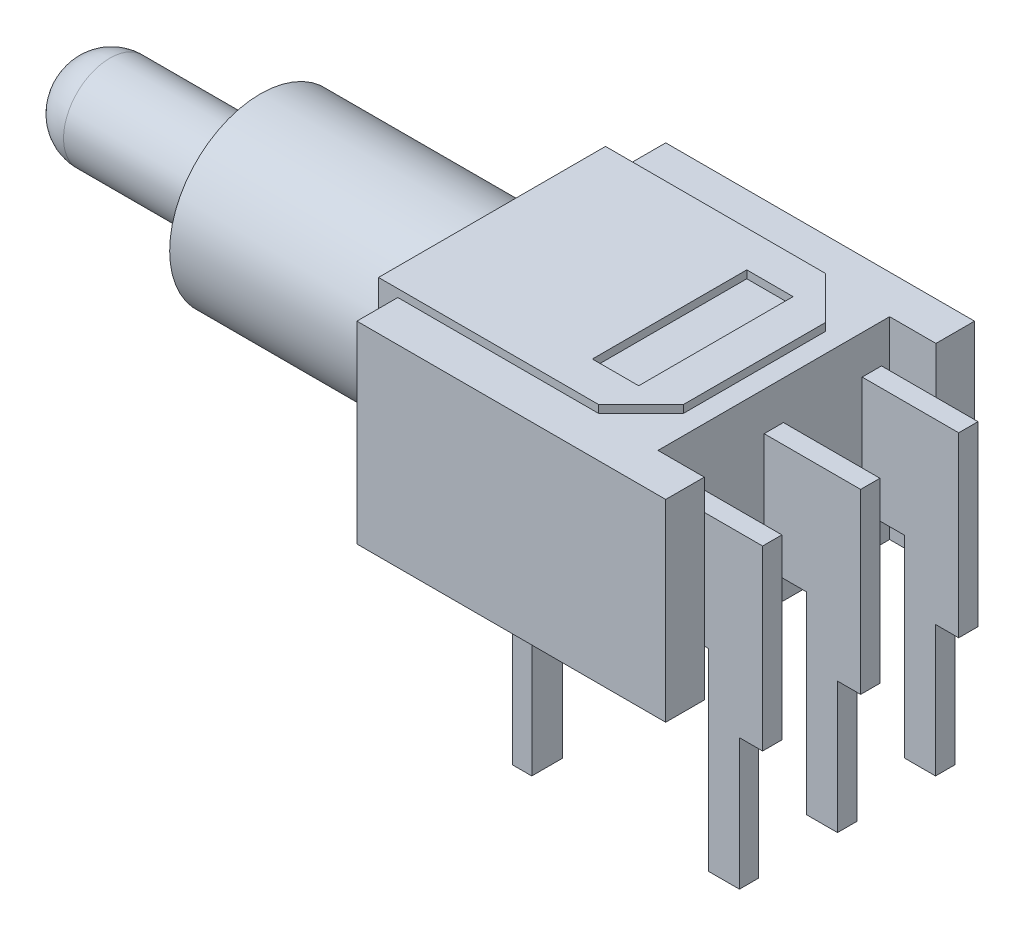
from build123d import *

# Parameters (mm, degrees)
BOSS_EXTRU_1_DEPTH         = 5
BOSS_EXTRU_2_DEPTH         = 0.25
BOSS_EXTRU_3_DEPTH         = 2.94
ESQUISSE6_W                = 4.28
ESQUISSE6_H                = 4
ENL_V_MAT_EXTRU_1_DEPTH    = 0.7
ESQUISSE7_R                = 2.35
ESQUISSE7_R_2              = 1.85
BOSS_EXTRU_4_DEPTH         = 6
ESQUISSE8_R                = 1.2
BOSS_EXTRU_5_DEPTH         = 11
CONG_1_R                   = 1.1
ESQUISSE9_W                = 1.2
ESQUISSE9_H                = 4
BOSS_EXTRU_6_DEPTH         = 0.2
R_P_TITION_LIN_AIRE1_COUNT = 2
R_P_TITION_LIN_AIRE1_PITCH = 2.54
R_P_TITION_LIN_AIRE2_COUNT = 2
R_P_TITION_LIN_AIRE2_PITCH = 2.54


with BuildPart() as part:
    # Esquisse1 → Boss.-Extru.1 (new body)
    with BuildSketch(Plane(origin=(0, 0, 0), x_dir=(1, 0, 0), z_dir=(0, 1, 0))):
        Polygon((0, 0), (8, 0), (8, 1), (6.8, 1), (6.8, 7), (8, 7), (8, 8), (0, 8), align=None)
    extrude(amount=BOSS_EXTRU_1_DEPTH)

    # Esquisse4 → Boss.-Extru.2 (add, symmetric)
    with BuildSketch(Plane.XY.offset(-4)):
        Polygon((6.8, 4), (6.8, 1), (7.9, 1), (7.9, -4), (8.7, -4), (8.7, -0.6), (9.3, -0.6), (9.3, 4), align=None)
    boss_extru_2 = extrude(amount=BOSS_EXTRU_2_DEPTH, both=True)

    # Esquisse5 → Boss.-Extru.3 (add, symmetric)
    with BuildSketch(Plane.XY.offset(-4)):
        with BuildLine():
            Line((0, 5.2), (0, 0))
            Line((0, 0), (2.77, 0))
            ThreePointArc((2.77, 0), (3.264974747, -0.205025253), (3.47, -0.7))
            Line((3.47, -0.7), (3.47, -4))
            Line((3.47, -4), (2.97, -4))
            Line((2.97, -4), (2.97, -0.7))
            ThreePointArc((2.97, -0.7), (2.911421356, -0.558578644), (2.77, -0.5))
            Line((2.77, -0.5), (-0.2, -0.5))
            ThreePointArc((-0.2, -0.5), (-0.412132034, -0.412132034), (-0.5, -0.2))
            Line((-0.5, -0.2), (-0.5, 5.2))
            Line((-0.5, 5.2), (0, 5.2))
        make_face()
    extrude(amount=BOSS_EXTRU_3_DEPTH, both=True)

    # Esquisse6 → Enlèv. mat.-Extru.1 (cut)
    with BuildSketch(Plane(origin=(3.47, 0, 0), x_dir=(0, 0, -1), z_dir=(1, 0, 0))):
        with Locations((4, -2)):
            Rectangle(ESQUISSE6_W, ESQUISSE6_H)
    extrude(amount=-ENL_V_MAT_EXTRU_1_DEPTH, mode=Mode.SUBTRACT)

    # Esquisse7 → Boss.-Extru.4 (add)
    with BuildSketch(Plane.ZY.offset(0.5)):
        with Locations(Location((-4, 2.5, 0), (0, 0, 90))):
            Circle(ESQUISSE7_R)
        with Locations(Location((-4, 2.5, 0), (0, 0, 270))):
            Circle(ESQUISSE7_R_2, mode=Mode.SUBTRACT)
    extrude(amount=BOSS_EXTRU_4_DEPTH)

    # Esquisse8 → Boss.-Extru.5 (add)
    with BuildSketch(Plane.ZY.offset(0.5)):
        with Locations(Location((-4, 2.5, 0), (0, 0, 90))):
            Circle(ESQUISSE8_R)
    extrude(amount=BOSS_EXTRU_5_DEPTH)

    # Congé1
    cong_1_edges = [part.edges().sort_by_distance(p)[0] for p in [
        (-11.5, 1.3, -4),
    ]]
    fillet(cong_1_edges, radius=CONG_1_R)

    # Esquisse9 → Boss.-Extru.6 (add)
    with BuildSketch(Plane(origin=(0, 5, 0), x_dir=(1, 0, 0), z_dir=(0, 1, 0))):
        Polygon((0, 6.94), (5.2, 6.94), (6.3, 5.84), (6.3, 2.16), (5.2, 1.06), (0, 1.06), align=None)
        with Locations((4.7, 4)):
            Rectangle(ESQUISSE9_W, ESQUISSE9_H, mode=Mode.SUBTRACT)
    extrude(amount=BOSS_EXTRU_6_DEPTH)

    # Répétition linéaire1: Boss.-Extru.2 ×2
    with Locations(*[(0, 0, -i * R_P_TITION_LIN_AIRE1_PITCH) for i in range(1, R_P_TITION_LIN_AIRE1_COUNT)]):
        add(boss_extru_2)

    # Répétition linéaire2: Boss.-Extru.2 ×2
    with Locations(*[(0, 0, i * R_P_TITION_LIN_AIRE2_PITCH) for i in range(1, R_P_TITION_LIN_AIRE2_COUNT)]):
        add(boss_extru_2)


solid = part.part
